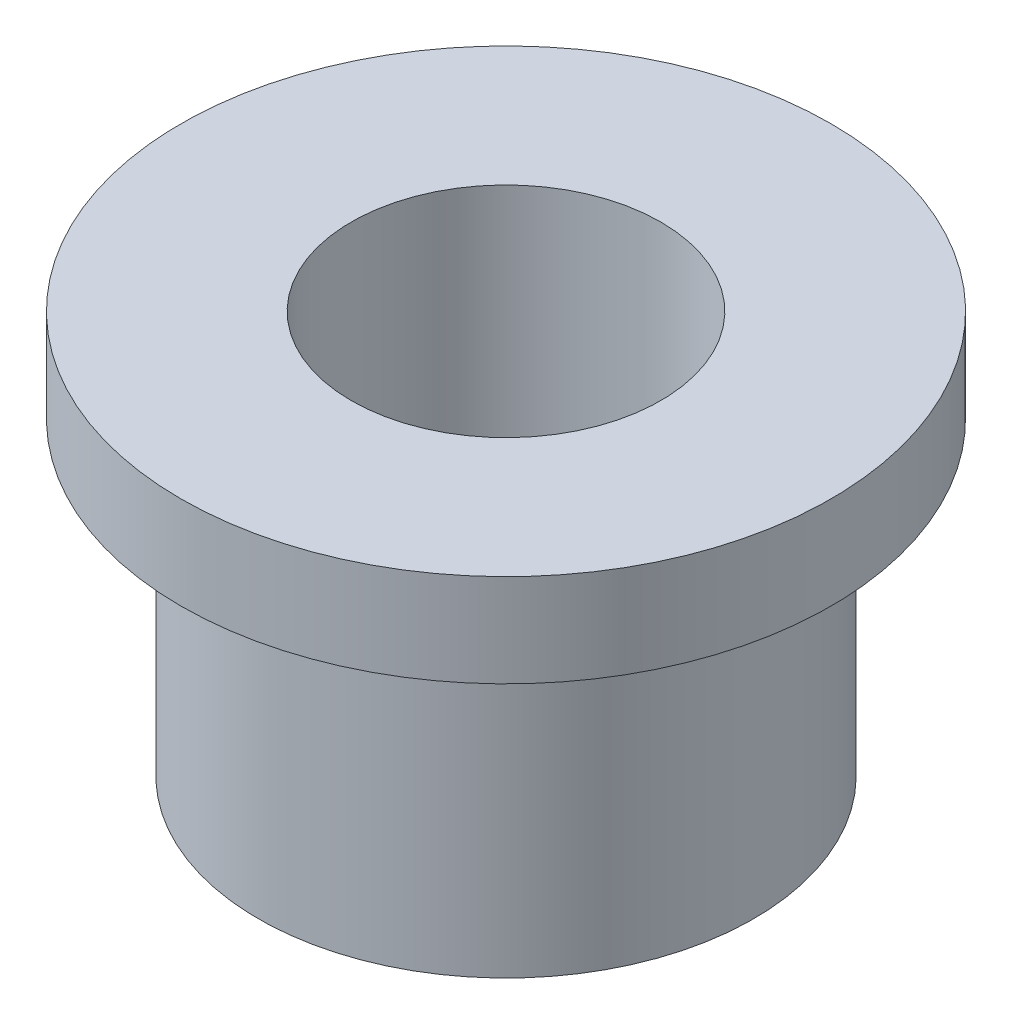
from build123d import *


with BuildPart() as part:
    # Sketch1 → Revolve1 (revolve)
    with BuildSketch(Plane.XY, mode=Mode.PRIVATE) as revolve1_sk:
        Polygon((2.5, 0), (2.5, 6.5), (5.25, 6.5), (5.25, 5), (4, 5), (4, 0), align=None)
    revolve(revolve1_sk.sketch.rotate(Axis((0, 0, 0), (0, 1, 0)), 90), axis=Axis((0, 0, 0), (0, 1, 0)))


solid = part.part
